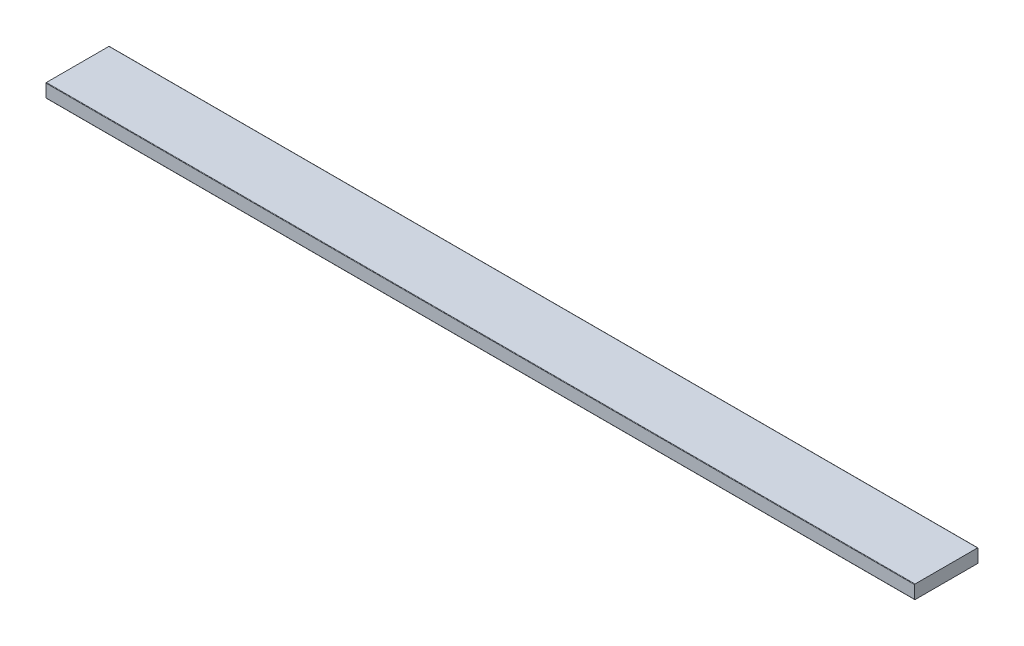
from build123d import *

# Parameters (mm, degrees)
BOSS_EXTRUDE1_DEPTH      = 4.7625
BOSS_EXTRUDE1_DEPTH_BACK = 4.7625
SKETCH3_W                = 609.6
SKETCH3_H                = 44.45
FILLET1_R                = 0.314325


with BuildPart() as part:
    # Sketch3 → Boss-Extrude1 (new, two sides: drawn at the far end of the back side and taken through both)
    with BuildSketch(Plane(origin=(0, 0, 0), x_dir=(1, 0, 0), z_dir=(0, 1, 0)).offset(-BOSS_EXTRUDE1_DEPTH_BACK)):
        Rectangle(SKETCH3_W, SKETCH3_H)
    extrude(amount=BOSS_EXTRUDE1_DEPTH + BOSS_EXTRUDE1_DEPTH_BACK)

    # Fillet1
    fillet1_edges = [part.edges().sort_by_distance(p)[0] for p in [
        (0, 4.7625, 22.225),
        (0, -4.7625, -22.225),
        (0, 4.7625, -22.225),
        (0, -4.7625, 22.225),
    ]]
    fillet(fillet1_edges, radius=FILLET1_R)


solid = part.part
